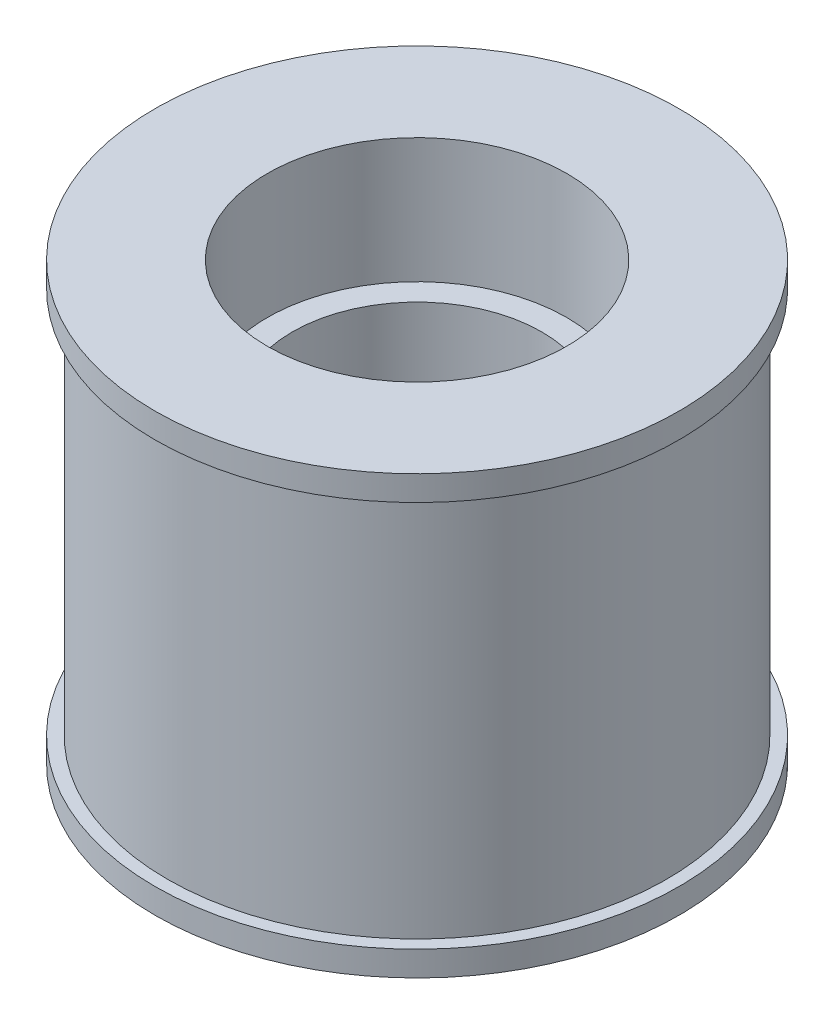
from build123d import *

# Parameters (mm, degrees)
SKETCH_1_R          = 21
EXTRUDE_1_DEPTH     = 17.5
SKETCH_2_W          = 1
SKETCH_2_H          = 31
SKETCH_3_R          = 12
CUT_EXTRUDE_1_DEPTH = 10
SKETCH_15_R         = 10
CUT_EXTRUDE_3_DEPTH = 39.820097888
SCALE1_SCALE        = 2


with BuildPart() as part:
    # 草图1 → 凸台-拉伸1 (new, symmetric)
    with BuildSketch(Plane(origin=(0, 0, 0), x_dir=(1, 0, 0), z_dir=(0, 1, 0))):
        with Locations(Location((0, 0, 0), (0, 0, 270))):
            Circle(SKETCH_1_R)
    extrude(amount=EXTRUDE_1_DEPTH, both=True)

    # 草图2 → 切除-旋转1 (revolve, cut)
    with BuildSketch(Plane.XY, mode=Mode.PRIVATE) as cut_revolve_1_sk:
        with Locations((20.5, 0)):
            Rectangle(SKETCH_2_W, SKETCH_2_H)
    revolve(cut_revolve_1_sk.sketch.rotate(Axis((0, 17.5, 0), (0, -1, 0)), 90), axis=Axis((0, 17.5, 0), (0, -1, 0)), mode=Mode.SUBTRACT)

    # 草图3 → 切除-拉伸1 (cut)
    with BuildSketch(Plane(origin=(0, 17.5, 0), x_dir=(1, 0, 0), z_dir=(0, 1, 0))):
        with Locations(Location((0, 0, 0), (0, 0, 270))):
            Circle(SKETCH_3_R)
    cut_extrude_1 = extrude(amount=-CUT_EXTRUDE_1_DEPTH, mode=Mode.SUBTRACT)

    # 草图15 → 切除-拉伸3 (cut, through all)
    with BuildSketch(Plane(origin=(0, 7.5, 0), x_dir=(1, 0, 0), z_dir=(0, 1, 0))):
        with Locations(Location((0, 0, 0), (0, 0, 270))):
            Circle(SKETCH_15_R)
    extrude(amount=-CUT_EXTRUDE_3_DEPTH, mode=Mode.SUBTRACT)

    # 镜向1: 切除-拉伸1 across plane
    add(cut_extrude_1.mirror(Plane.ZX), mode=Mode.SUBTRACT)


with BuildPart() as part_1:
    # Scale1: scaled about (0, 0, 0)
    add(part.part.scale(SCALE1_SCALE))


solid = part_1.part
